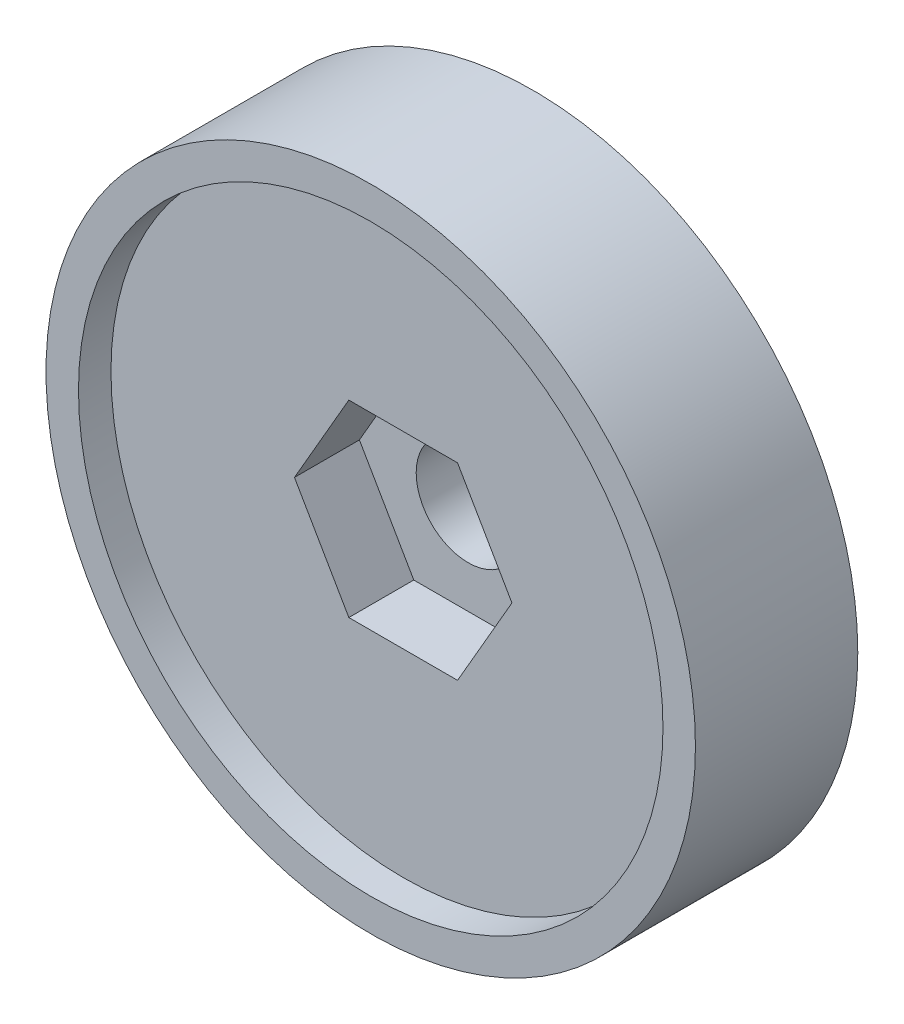
from build123d import *

# Parameters (mm, degrees)
SKETCH1_R           = 10
SKETCH1_R_2         = 1.5
BOSS_EXTRUDE1_DEPTH = 2
SKETCH2_R           = 10
SKETCH2_R_2         = 1.5
BOSS_EXTRUDE2_DEPTH = 3
SKETCH3_R           = 1.6
CUT_EXTRUDE1_DEPTH  = 131.958008585
CUT_EXTRUDE2_DEPTH  = 3
SKETCH5_R           = 9
CUT_EXTRUDE3_DEPTH  = 1


with BuildPart() as part:
    # Sketch1 → Boss-Extrude1 (new body)
    with BuildSketch(Plane.XY):
        with Locations((-85.000000067, 80)):
            Circle(SKETCH1_R)
        with Locations((-85.000000067, 80)):
            Circle(SKETCH1_R_2, mode=Mode.SUBTRACT)
    extrude(amount=BOSS_EXTRUDE1_DEPTH)

    # Sketch2 → Boss-Extrude2 (add)
    # profile 1 of 2: a face of its own
    with BuildSketch(Plane.XY.offset(2)):
        with Locations((-85.000000067, 80)):
            Circle(SKETCH2_R)
        with Locations((-85.000000067, 80)):
            Circle(SKETCH2_R_2, mode=Mode.SUBTRACT)
    # profile 2 of 2: a face of its own
    with BuildSketch(Plane.XY.offset(2)):
        with Locations((-85.000000067, 80)):
            Circle(SKETCH2_R_2)
    extrude(amount=BOSS_EXTRUDE2_DEPTH)

    # Sketch3 → Cut-Extrude1 (cut, through all)
    with BuildSketch(Plane(origin=(0, 0, 0), x_dir=(-1, 0, 0), z_dir=(0, 0, -1))):
        with Locations((85.000000067, 80)):
            Circle(SKETCH3_R)
    extrude(amount=-CUT_EXTRUDE1_DEPTH, mode=Mode.SUBTRACT)

    # Sketch4 → Cut-Extrude2 (cut)
    with BuildSketch(Plane.XY.offset(5)):
        Polygon((-88.348631628, 80), (-86.674315847, 77.1), (-83.325684286, 77.1), (-81.651368505, 80), (-83.325684286, 82.9), (-86.674315847, 82.9), align=None)
    extrude(amount=-CUT_EXTRUDE2_DEPTH, mode=Mode.SUBTRACT)

    # Sketch5 → Cut-Extrude3 (cut)
    with BuildSketch(Plane.XY.offset(5)):
        with Locations((-85.000000067, 80)):
            Circle(SKETCH5_R)
    extrude(amount=-CUT_EXTRUDE3_DEPTH, mode=Mode.SUBTRACT)


solid = part.part
